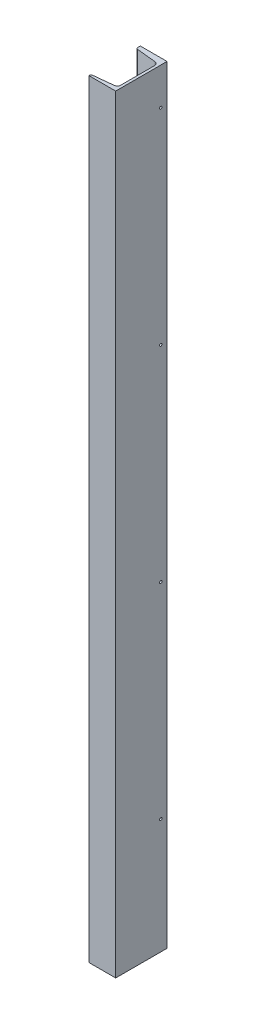
from build123d import *

# Parameters (mm, degrees)
C_CHANNEL_120_X_12_5_DEPTH = 1870
SKETCH16_R                 = 3
CUT_EXTRUDE1_DEPTH         = 1876.299976004


with BuildPart() as part:
    # Sketch1 → C channel 120 X 12(5) (new body)
    with BuildSketch(Plane(origin=(0, 0, 0), x_dir=(-1, 0, 0), z_dir=(0, 1, 0))):
        with BuildLine():
            Line((65, 125), (0, 125))
            Line((0, 125), (0, 0))
            Line((0, 0), (65, 0))
            Line((65, 0), (65, 5.845330836))
            ThreePointArc((65, 5.845330836), (63.844151715, 8.856418565), (60.970378085, 10.320679365))
            Line((60.970378085, 10.320679365), (13.463772294, 15.313824837))
            ThreePointArc((13.463772294, 15.313824837), (8.354841396, 17.916955149), (6.3, 23.27))
            Line((6.3, 23.27), (6.3, 106.74))
            ThreePointArc((6.3, 106.74), (8.354841396, 112.093044851), (13.463772294, 114.696175163))
            Line((13.463772294, 114.696175163), (60.970378085, 119.689320635))
            ThreePointArc((60.970378085, 119.689320635), (63.844151715, 121.153581435), (65, 124.164669164))
            Line((65, 124.164669164), (65, 125))
        make_face()
    extrude(amount=C_CHANNEL_120_X_12_5_DEPTH)

    # Sketch16 → Cut-Extrude1 (cut, through all)
    with BuildSketch(Plane(origin=(0, 0, 0), x_dir=(0, 0, -1), z_dir=(1, 0, 0))):
        with Locations((-15.2, 280)):
            Circle(SKETCH16_R)
        with Locations((-15.2, 780)):
            Circle(SKETCH16_R)
        with Locations((-15.2, 1280)):
            Circle(SKETCH16_R)
        with Locations((-15.2, 1780)):
            Circle(SKETCH16_R)
    extrude(amount=-CUT_EXTRUDE1_DEPTH, mode=Mode.SUBTRACT)


solid = part.part
